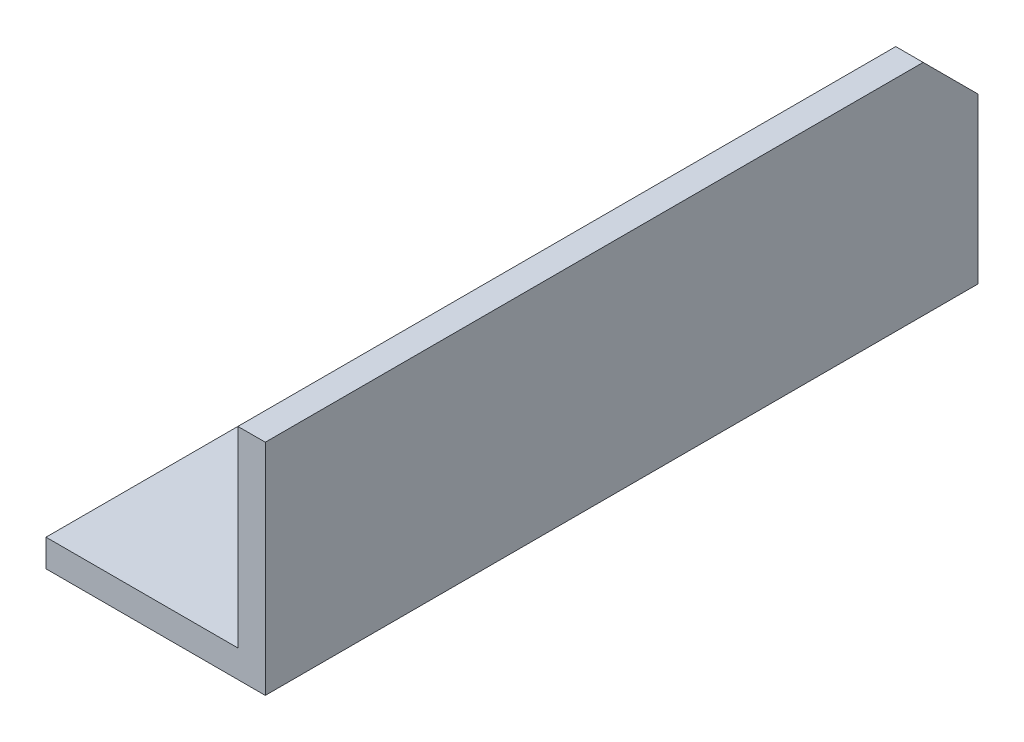
from build123d import *

# Parameters (mm, degrees)
EXTRUDE_THIN1_DEPTH      = 65
EXTRUDE_THIN1_DEPTH_BACK = 65
CHAMFER1_SIZE            = 10
SKETCH4_R                = 5
CUT_EXTRUDE2_DEPTH       = 10


with BuildPart() as part:
    # Sketch2 → Extrude-Thin1 (new, two sides: drawn at the far end of the back side and taken through both)
    with BuildSketch(Plane.XY.offset(-EXTRUDE_THIN1_DEPTH_BACK)):
        Polygon((-40, 0), (0, 0), (0, 40), (-5, 40), (-5, 5), (-40, 5), align=None)
    extrude(amount=EXTRUDE_THIN1_DEPTH + EXTRUDE_THIN1_DEPTH_BACK)

    # Chamfer1
    chamfer1_edges = [part.edges().sort_by_distance(p)[0] for p in [
        (-40, 2.5, -65),
        (-2.5, 40, -65),
    ]]
    chamfer(chamfer1_edges, length=CHAMFER1_SIZE)

    # Sketch4 → Cut-Extrude2 (cut)
    with BuildSketch(Plane(origin=(0, 5, 0), x_dir=(1, 0, 0), z_dir=(0, 1, 0))):
        with Locations(Location((-20, 38, 0), (0, 0, 270))):
            Circle(SKETCH4_R)
    extrude(amount=-CUT_EXTRUDE2_DEPTH, mode=Mode.SUBTRACT)


solid = part.part
